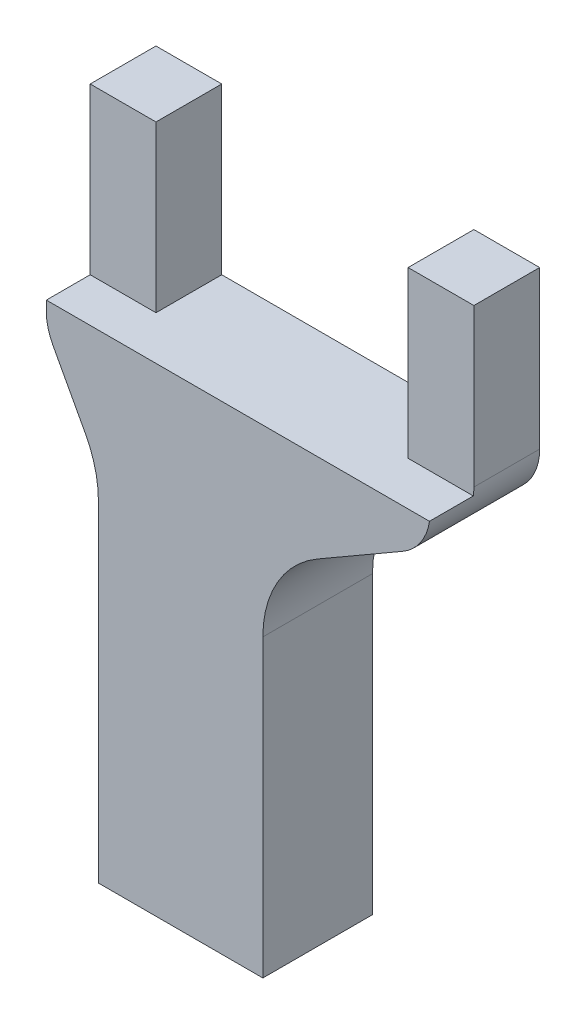
from build123d import *

# Parameters (mm, degrees)
BOSS_EXTRUDE1_DEPTH = 10
FILLET1_R           = 10
FILLET2_R           = 5
SKETCH2_W           = 35
SKETCH2_H           = 15.070963555
CUT_EXTRUDE1_DEPTH  = 4


with BuildPart() as part:
    # Sketch1 → Boss-Extrude1 (new body)
    with BuildSketch(Plane.XY):
        Polygon((-7.5, 467.320715151), (-7.5, 500.037974444), (-12.25, 508.842566049), (-12.25, 526.07117063), (-6.25, 526.07117063), (-6.25, 511.000207075), (16.75, 511.000207075), (16.75, 526.07117063), (22.75, 526.07117063), (22.75, 508.842566049), (7.5, 500.037974444), (7.5, 467.320715151), align=None)
    extrude(amount=BOSS_EXTRUDE1_DEPTH)

    # Fillet1
    fillet1_edges = [part.edges().sort_by_distance(p)[0] for p in [
        (7.5, 500.037974444, 5),
        (-7.5, 500.037974444, 5),
    ]]
    fillet(fillet1_edges, radius=FILLET1_R)

    # Fillet2
    fillet2_edges = [part.edges().sort_by_distance(p)[0] for p in [
        (22.75, 508.842566049, 5),
        (-12.25, 508.842566049, 5),
    ]]
    fillet(fillet2_edges, radius=FILLET2_R)

    # Sketch2 → Cut-Extrude1 (cut)
    with BuildSketch(Plane.XY.offset(10)):
        with Locations((5.25, 518.535688853)):
            Rectangle(SKETCH2_W, SKETCH2_H)
    extrude(amount=-CUT_EXTRUDE1_DEPTH, mode=Mode.SUBTRACT)


solid = part.part
